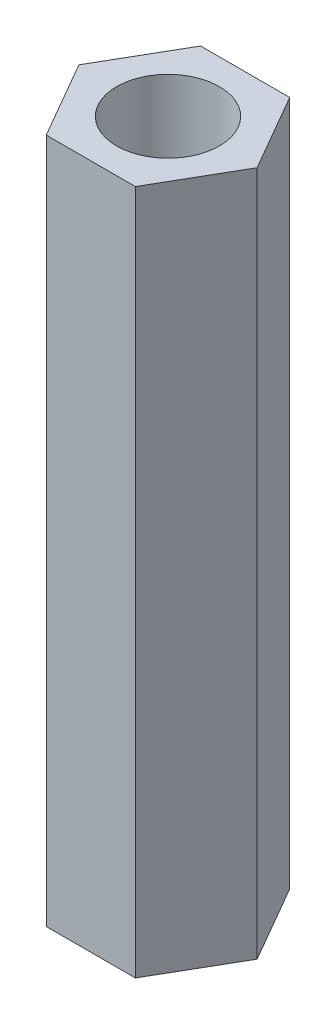
from build123d import *

# Parameters (mm, degrees)
SKETCH_1_R      = 1.5
EXTRUDE_1_DEPTH = 20


with BuildPart() as part:
    # 草图1 → 凸台-拉伸1 (new body)
    with BuildSketch(Plane(origin=(0, 0, 0), x_dir=(1, 0, 0), z_dir=(0, 1, 0))):
        Polygon((2.6, 0), (1.3, 2.25166605), (-1.3, 2.25166605), (-2.6, 0), (-1.3, -2.25166605), (1.3, -2.25166605), align=None)
        with Locations(Location((0, 0, 0), (0, 0, 270))):
            Circle(SKETCH_1_R, mode=Mode.SUBTRACT)
    extrude(amount=EXTRUDE_1_DEPTH)


solid = part.part
